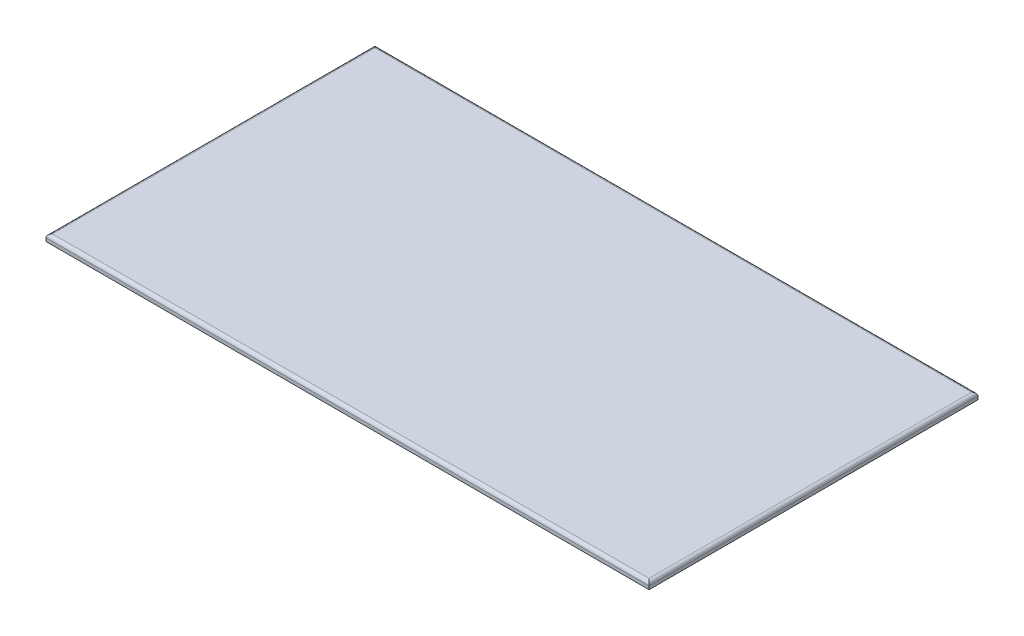
from build123d import *

# Parameters (mm, degrees)
SKETCH1_W           = 550
SKETCH1_H           = 300
BOSS_EXTRUDE1_DEPTH = 6
FILLET1_R           = 3
SKETCH3_W           = 500
SKETCH3_H           = 250
BOSS_EXTRUDE2_DEPTH = 26
FILLET2_R           = 6


with BuildPart() as part:
    # Sketch1 → Boss-Extrude1 (new body)
    with BuildSketch(Plane(origin=(0, 0, 0), x_dir=(1, 0, 0), z_dir=(0, 1, 0))):
        with Locations((275, 150)):
            Rectangle(SKETCH1_W, SKETCH1_H)
    extrude(amount=BOSS_EXTRUDE1_DEPTH)

    # Fillet1
    fillet1_edges = [part.edges().sort_by_distance(p)[0] for p in [
        (550, 6, -150),
        (275, 6, -300),
        (0, 6, -150),
        (275, 6, 0),
    ]]
    fillet(fillet1_edges, radius=FILLET1_R)

    # Sketch3 → Boss-Extrude2 (add)
    with BuildSketch(Plane.XZ):
        with Locations((275, -150)):
            Rectangle(SKETCH3_W, SKETCH3_H)
    extrude(amount=BOSS_EXTRUDE2_DEPTH)

    # Fillet2
    fillet2_edges = [part.edges().sort_by_distance(p)[0] for p in [
        (25, -13, -275),
        (525, -13, -275),
        (525, -13, -25),
        (25, -13, -25),
        (275, -26, -275),
        (525, -26, -150),
        (275, -26, -25),
        (25, -26, -150),
    ]]
    fillet(fillet2_edges, radius=FILLET2_R)


solid = part.part
